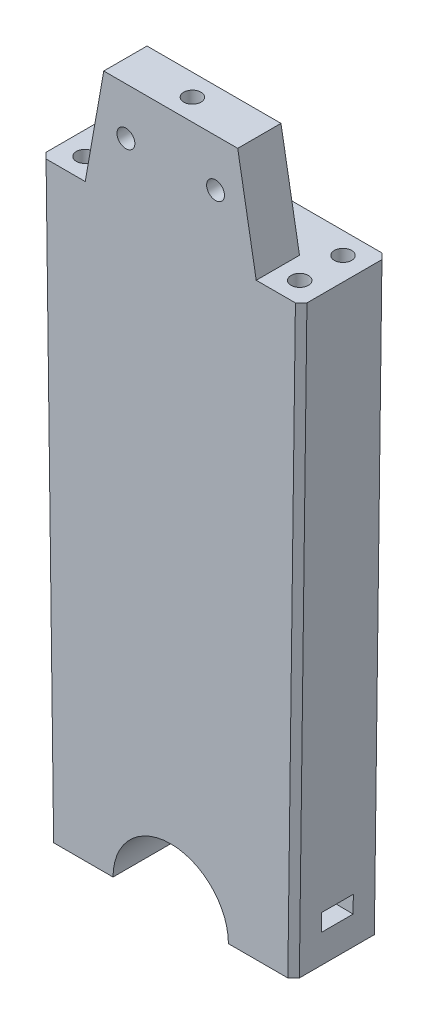
from build123d import *

# Parameters (mm, degrees)
SKETCH_1_R          = 1.55
EXTRUDE_1_DEPTH     = 15
CUT_EXTRUDE_1_DEPTH = 18.2
SKETCH_3_R          = 1.5
CUT_EXTRUDE_2_DEPTH = 12
SKETCH_4_R          = 1.5
CUT_EXTRUDE_3_DEPTH = 12
CHAMFER_1_SIZE      = 1
CUT_EXTRUDE_4_DEPTH = 9.5
CUT_EXTRUDE_5_DEPTH = 9.5
SKETCH_7_R          = 1.45
CUT_EXTRUDE_6_DEPTH = 20


with BuildPart() as part:
    # 草图1 → 凸台-拉伸1 (new body)
    with BuildSketch(Plane.XY):
        with BuildLine():
            Line((-10.835, -18.4), (-9.52124, -120.4))
            Line((-9.52124, -120.4), (1.775, -120.4))
            ThreePointArc((1.775, -120.4), (11.775, -110.4), (21.775, -120.4))
            Line((21.775, -120.4), (33.07124, -120.4))
            Line((33.07124, -120.4), (34.385, -18.4))
            Line((34.385, -18.4), (26.795, -18.4))
            Line((26.795, -18.4), (26.595, -18.4))
            Line((26.595, -18.4), (23.385271739, -0.2))
            Line((23.385271739, -0.2), (0.164728261, -0.2))
            Line((0.164728261, -0.2), (-3.045, -18.4))
            Line((-3.045, -18.4), (-3.245, -18.4))
            Line((-3.245, -18.4), (-10.835, -18.4))
        make_face()
        with Locations((4.005, -8.4)):
            Circle(SKETCH_1_R, mode=Mode.SUBTRACT)
        with Locations((19.545, -8.4)):
            Circle(SKETCH_1_R, mode=Mode.SUBTRACT)
    extrude(amount=EXTRUDE_1_DEPTH)

    # 草图2 → 切除-拉伸1 (cut)
    with BuildSketch(Plane(origin=(0, -0.2, 0), x_dir=(1, 0, 0), z_dir=(0, 1, 0))):
        Polygon((23.385271739, -7.5), (-22.23859784, -7.5), (-22.23859784, 0), (39.198950906, 0), (39.198950906, -7.5), align=None)
    extrude(amount=-CUT_EXTRUDE_1_DEPTH, mode=Mode.SUBTRACT)

    # 草图3 → 切除-拉伸2 (cut)
    with BuildSketch(Plane(origin=(0, -0.2, 0), x_dir=(1, 0, 0), z_dir=(0, 1, 0))):
        with Locations(Location((11.775, -11.25, 0), (0, 0, 270))):
            Circle(SKETCH_3_R)
    extrude(amount=-CUT_EXTRUDE_2_DEPTH, mode=Mode.SUBTRACT)

    # 草图4 → 切除-拉伸3 (cut)
    with BuildSketch(Plane(origin=(0, -18.4, 0), x_dir=(1, 0, 0), z_dir=(0, 1, 0))):
        with Locations(Location((30.385, -3.75, 0), (0, 0, 180))):
            Circle(SKETCH_4_R)
        with Locations(Location((30.385, -11.25, 0), (0, 0, 180))):
            Circle(SKETCH_4_R)
        with Locations((-6.835, -11.25)):
            Circle(SKETCH_4_R)
        with Locations((-6.835, -3.75)):
            Circle(SKETCH_4_R)
    extrude(amount=-CUT_EXTRUDE_3_DEPTH, mode=Mode.SUBTRACT)

    # 倒角1
    chamfer_1_edges = [part.edges().sort_by_distance(p)[0] for p in [
        (33.72812, -69.4, 15),
        (-10.17812, -69.4, 0),
        (33.72812, -69.4, 0),
        (-10.17812, -69.4, 15),
    ]]
    chamfer(chamfer_1_edges, length=CHAMFER_1_SIZE)

    # 草图5 → 切除-拉伸4 (cut)
    with BuildSketch(Plane(origin=(34.616249358, -0.445857292, 0), x_dir=(0, 0, -1), z_dir=(0.9999170631189305, -0.012878931772971664, 0))):
        Polygon((-7.5, -114.964092156), (-4.75, -114.964092156), (-4.75, -111.964092156), (-10.25, -111.964092156), (-10.25, -114.964092156), align=None)
    extrude(amount=-CUT_EXTRUDE_4_DEPTH, mode=Mode.SUBTRACT)

    # 草图6 → 切除-拉伸5 (cut)
    with BuildSketch(Plane(origin=(-11.070155523, -0.142583603, 0), x_dir=(0, 0, 1), z_dir=(-0.9999170631189305, -0.012878931772971934, 0))):
        Polygon((7.5, -115.267390999), (4.75, -115.267390999), (4.75, -112.267390999), (10.25, -112.267390999), (10.25, -115.267390999), align=None)
    extrude(amount=-CUT_EXTRUDE_5_DEPTH, mode=Mode.SUBTRACT)

    # 草图7 → 切除-拉伸6 (cut)
    with BuildSketch(Plane.XZ.offset(120.4)):
        with Locations(Location((27.425, 7.5, 0), (0, 0, 270))):
            Circle(SKETCH_7_R)
        with Locations(Location((-3.875, 7.5, 0), (0, 0, 270))):
            Circle(SKETCH_7_R)
    extrude(amount=-CUT_EXTRUDE_6_DEPTH, mode=Mode.SUBTRACT)


solid = part.part
